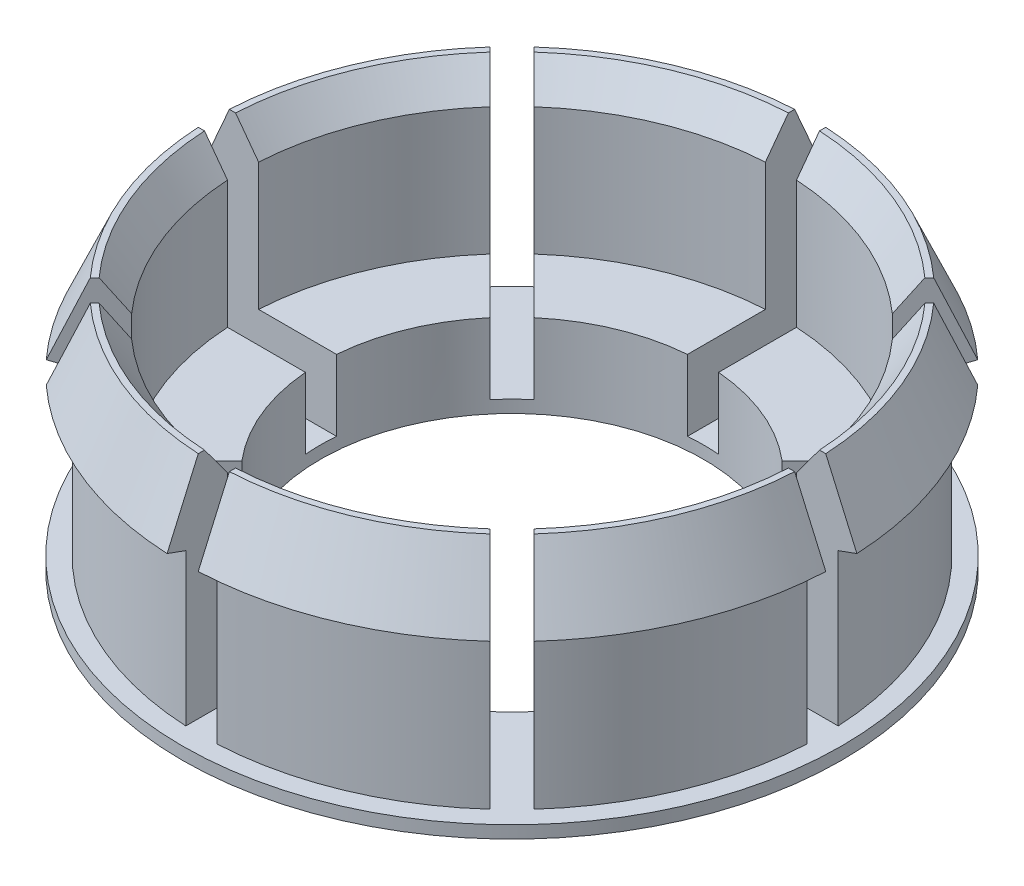
from build123d import *

# Parameters (mm, degrees)
CUT_EXTRUDE3_REACH             = 23.451
SKETCH6_W                      = 1.27
SKETCH6_H                      = 13.462
CUT_EXTRUDE3_DIRECTION_2_DEPTH = 22.45051463
CIRPATTERN1_COUNT              = 8


with BuildPart() as part:
    # Sketch5 → Revolve1 (revolve)
    with BuildSketch(Plane.XY, mode=Mode.PRIVATE) as revolve1_sk:
        Polygon((-11, -3.2385), (-11, 1.9685), (-11.938, 3.2385), (-12.192, 3.2385), (-13.462, 0.340845319), (-12.7, 0.0635), (-12.7, -6.136500046), (-13.462, -6.136500046), (-13.462, -6.644500046), (-7.825, -6.644500046), (-7.825, -3.2385), align=None)
    revolve(revolve1_sk.sketch.rotate(Axis((0, 0.0635, 0), (0, -1, 0)), 270), axis=Axis((0, 0.0635, 0), (0, -1, 0)))

    # Cut-Extrude3: up to this face of the body (flat: up to its plane)
    cut_extrude3_end = Plane(part.part.faces().sort_by_distance((0, -6.136500046, -13.08076286))[0])
    # Sketch6 → Cut-Extrude3 (cut, up to the picked face)
    with BuildSketch(Plane(origin=(0, 3.2385, 0), x_dir=(1, 0, 0), z_dir=(0, 1, 0)), mode=Mode.PRIVATE) as cut_extrude3_sk1:
        with Locations((0, 6.731)):
            Rectangle(SKETCH6_W, SKETCH6_H)
    cut_extrude3_tool1 = split(extrude(cut_extrude3_sk1.sketch, amount=-CUT_EXTRUDE3_REACH, mode=Mode.PRIVATE), bisect_by=cut_extrude3_end, keep=Keep.BOTH, mode=Mode.PRIVATE)
    cut_extrude3 = cut_extrude3_tool1.solids().sort_by(Axis((0, 3.2385, -6.731), (0, -1, 0)))[0]
    add(cut_extrude3, mode=Mode.SUBTRACT)

    # Sketch6 → Cut-Extrude3 direction 2 (cut)
    with BuildSketch(Plane(origin=(0, 3.2385, 0), x_dir=(1, 0, 0), z_dir=(0, 1, 0))):
        with Locations((0, 6.731)):
            Rectangle(SKETCH6_W, SKETCH6_H)
    cut_extrude3_direction_2 = extrude(amount=CUT_EXTRUDE3_DIRECTION_2_DEPTH, mode=Mode.SUBTRACT)

    # CirPattern1: Cut-Extrude3, Cut-Extrude3 direction 2 ×8 about axis
    cirpattern1_axis = Axis((0, 0, 0), (0, 1, 0))
    add([cut_extrude3.rotate(cirpattern1_axis, i * 360 / CIRPATTERN1_COUNT) for i in range(1, CIRPATTERN1_COUNT)], mode=Mode.SUBTRACT)
    add([cut_extrude3_direction_2.rotate(cirpattern1_axis, i * 360 / CIRPATTERN1_COUNT) for i in range(1, CIRPATTERN1_COUNT)], mode=Mode.SUBTRACT)


solid = part.part
